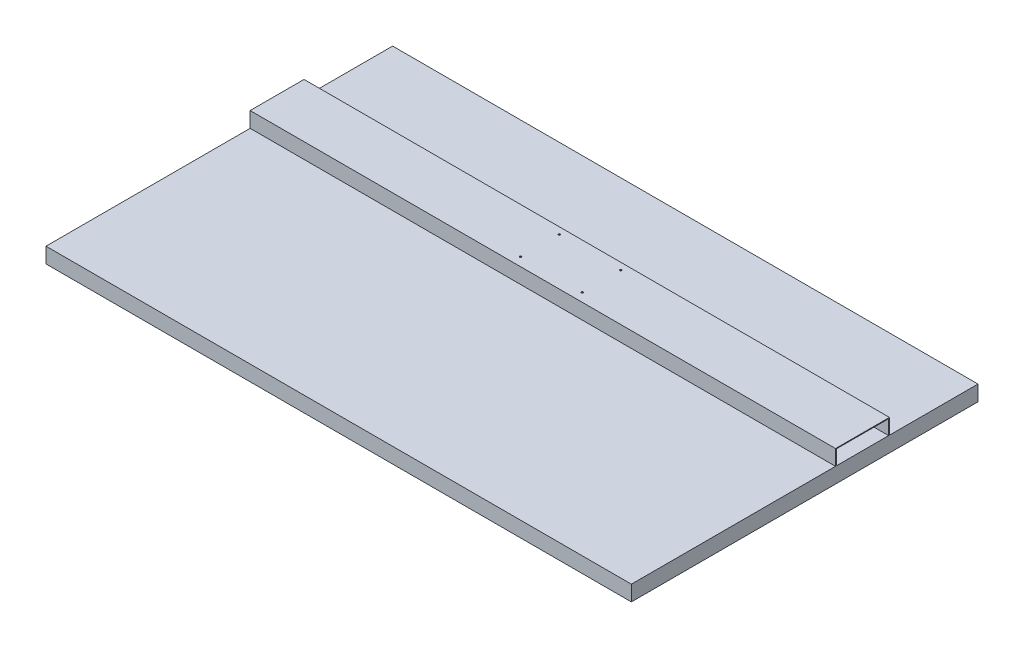
from build123d import *

# Parameters (mm, degrees)
SKETCH1_W           = 1930.4
SKETCH1_H           = 1143
BOSS_EXTRUDE1_DEPTH = 50.8
SKETCH2_W           = 1861.76231229
SKETCH2_H           = 1069.640341316
CUT_EXTRUDE1_DEPTH  = 3.048
BOSS_EXTRUDE3_DEPTH = 1930.4
CUT_EXTRUDE2_REACH  = 1128.297
SKETCH4_R           = 3.175


with BuildPart() as part:
    # Sketch1 → Boss-Extrude1 (new body)
    with BuildSketch(Plane(origin=(0, 0, 0), x_dir=(1, 0, 0), z_dir=(0, 1, 0))):
        Rectangle(SKETCH1_W, SKETCH1_H)
    extrude(amount=BOSS_EXTRUDE1_DEPTH)

    # Sketch2 → Cut-Extrude1 (cut)
    with BuildSketch(Plane(origin=(0, 0, 0), x_dir=(1, 0, 0), z_dir=(0, 1, 0))):
        Rectangle(SKETCH2_W, SKETCH2_H)
    extrude(amount=CUT_EXTRUDE1_DEPTH, mode=Mode.SUBTRACT)

    # Sketch3 → Boss-Extrude3 (add, through all)
    with BuildSketch(Plane(origin=(965.2, 0, 0), x_dir=(0, 0, -1), z_dir=(1, 0, 0))):
        Polygon((101.6, 50.8), (104.14, 50.8), (104.14, 99.06), (276.86, 99.06), (276.86, 50.8), (279.4, 50.8), (279.4, 101.6), (101.6, 101.6), align=None)
    extrude(amount=-BOSS_EXTRUDE3_DEPTH)

    # Sketch4 → Cut-Extrude2 (cut, up to next)
    with BuildSketch(Plane(origin=(0, 101.6, 0), x_dir=(1, 0, 0), z_dir=(0, 1, 0)), mode=Mode.PRIVATE) as cut_extrude2_sk1:
        with Locations(Location((101.6, 130.175, 0), (0, 0, 270))):
            Circle(SKETCH4_R)
    cut_extrude2_tool1 = extrude(cut_extrude2_sk1.sketch, amount=-CUT_EXTRUDE2_REACH, mode=Mode.PRIVATE) & part.part
    # Sketch4 → Cut-Extrude2 (cut, up to next)
    with BuildSketch(Plane(origin=(0, 101.6, 0), x_dir=(1, 0, 0), z_dir=(0, 1, 0)), mode=Mode.PRIVATE) as cut_extrude2_sk2:
        with Locations(Location((-101.6, 130.175, 0), (0, 0, 270))):
            Circle(SKETCH4_R)
    cut_extrude2_tool2 = extrude(cut_extrude2_sk2.sketch, amount=-CUT_EXTRUDE2_REACH, mode=Mode.PRIVATE) & part.part
    # Sketch4 → Cut-Extrude2 (cut, up to next)
    with BuildSketch(Plane(origin=(0, 101.6, 0), x_dir=(1, 0, 0), z_dir=(0, 1, 0)), mode=Mode.PRIVATE) as cut_extrude2_sk3:
        with Locations(Location((-101.6, 257.175, 0), (0, 0, 270))):
            Circle(SKETCH4_R)
    cut_extrude2_tool3 = extrude(cut_extrude2_sk3.sketch, amount=-CUT_EXTRUDE2_REACH, mode=Mode.PRIVATE) & part.part
    # Sketch4 → Cut-Extrude2 (cut, up to next)
    with BuildSketch(Plane(origin=(0, 101.6, 0), x_dir=(1, 0, 0), z_dir=(0, 1, 0)), mode=Mode.PRIVATE) as cut_extrude2_sk4:
        with Locations(Location((101.6, 257.175, 0), (0, 0, 270))):
            Circle(SKETCH4_R)
    cut_extrude2_tool4 = extrude(cut_extrude2_sk4.sketch, amount=-CUT_EXTRUDE2_REACH, mode=Mode.PRIVATE) & part.part
    add(cut_extrude2_tool1.solids().sort_by_distance((101.6, 101.6, -130.175))[0], mode=Mode.SUBTRACT)
    add(cut_extrude2_tool2.solids().sort_by_distance((-101.6, 101.6, -130.175))[0], mode=Mode.SUBTRACT)
    add(cut_extrude2_tool3.solids().sort_by_distance((-101.6, 101.6, -257.175))[0], mode=Mode.SUBTRACT)
    add(cut_extrude2_tool4.solids().sort_by_distance((101.6, 101.6, -257.175))[0], mode=Mode.SUBTRACT)


solid = part.part
